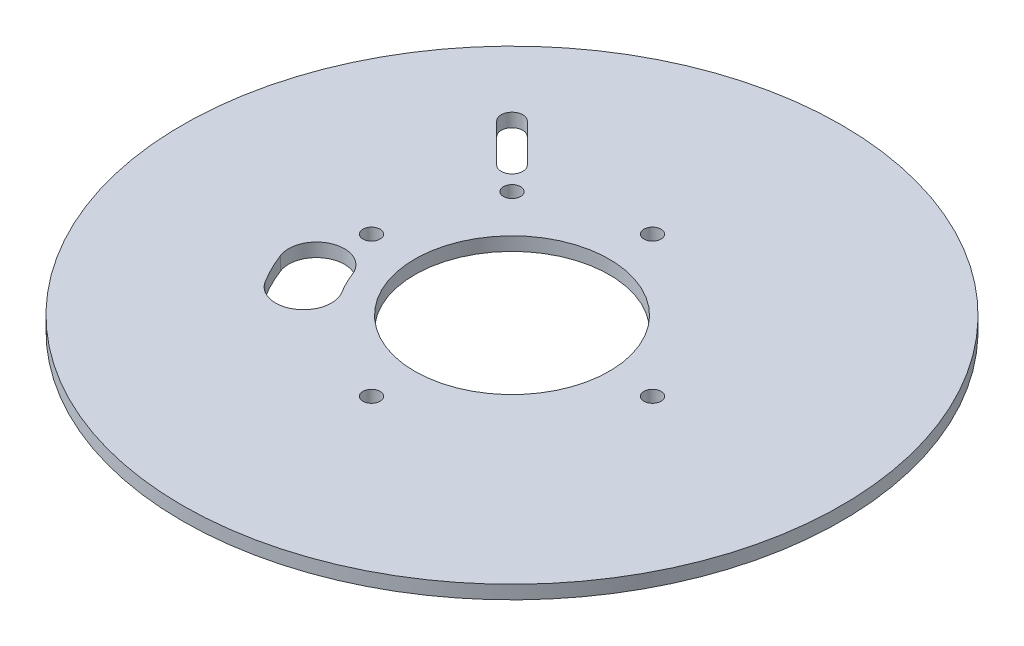
from build123d import *

# Parameters (mm, degrees)
SKETCH1_R           = 77.4600051
BOSS_EXTRUDE1_DEPTH = 3.175
SKETCH20_R          = 22.86
SKETCH20_R_2        = 2.0193
CUT_EXTRUDE10_DEPTH = 250.596695835
CUT_EXTRUDE11_DEPTH = 3.175
SKETCH22_R          = 2.0193
CUT_EXTRUDE12_DEPTH = 250.596695835
CUT_EXTRUDE13_DEPTH = 250.596695835


with BuildPart() as part:
    # Sketch1 → Boss-Extrude1 (new body)
    with BuildSketch(Plane(origin=(0, 0, 0), x_dir=(1, 0, 0), z_dir=(0, 1, 0))):
        with Locations(Location((0, 0, 0), (0, 0, 270))):
            Circle(SKETCH1_R)
    extrude(amount=BOSS_EXTRUDE1_DEPTH)

    # Sketch20 → Cut-Extrude10 (cut, through all)
    with BuildSketch(Plane(origin=(-73.768816189, 3.175, -121.080352405), x_dir=(1, 0, 0), z_dir=(0, 1, 0))):
        with Locations(Location((73.768816189, -121.080352405, 0), (0, 0, 270))):
            Circle(SKETCH20_R)
        with Locations(Location((73.768816189, -88.060352405, 0), (0, 0, 270))):
            Circle(SKETCH20_R_2)
        with Locations(Location((106.788816189, -121.080352405, 0), (0, 0, 270))):
            Circle(SKETCH20_R_2)
        with Locations(Location((73.768816189, -154.100352405, 0), (0, 0, 270))):
            Circle(SKETCH20_R_2)
        with Locations(Location((40.748816189, -121.080352405, 0), (0, 0, 270))):
            Circle(SKETCH20_R_2)
    extrude(amount=-CUT_EXTRUDE10_DEPTH, mode=Mode.SUBTRACT)

    # Sketch21 → Cut-Extrude11 (cut)
    with BuildSketch(Plane(origin=(-73.768816189, 3.175, -121.080352405), x_dir=(1, 0, 0), z_dir=(0, 1, 0))):
        with BuildLine():
            Line((41.420818538, -92.324457203), (32.440562417, -83.344201082))
            ThreePointArc((32.440562417, -83.344201082), (32.440562417, -79.752098633), (36.032664865, -79.752098633))
            Line((36.032664865, -79.752098633), (45.012920986, -88.732354754))
            ThreePointArc((45.012920986, -88.732354754), (45.012920986, -92.324457203), (41.420818538, -92.324457203))
        make_face()
    extrude(amount=-CUT_EXTRUDE11_DEPTH, mode=Mode.SUBTRACT)

    # Sketch22 → Cut-Extrude12 (cut, through all)
    with BuildSketch(Plane(origin=(-73.768816189, 3.175, -121.080352405), x_dir=(1, 0, 0), z_dir=(0, 1, 0))):
        with Locations(Location((48.605023435, -95.916559651, 0), (0, 0, 270))):
            Circle(SKETCH22_R)
    extrude(amount=-CUT_EXTRUDE12_DEPTH, mode=Mode.SUBTRACT)

    # Sketch23 → Cut-Extrude13 (cut, through all)
    with BuildSketch(Plane(origin=(-73.768816189, 3.175, -121.080352405), x_dir=(1, 0, 0), z_dir=(0, 1, 0))):
        with BuildLine():
            ThreePointArc((34.405967979, -136.122213123), (36.00963526, -139.786919397), (37.953573181, -143.283049568))
            ThreePointArc((37.953573181, -143.283049568), (46.974494303, -145.399596657), (49.091041391, -136.378675534))
            ThreePointArc((49.091041391, -136.378675534), (47.751609959, -133.969737166), (46.646635186, -131.444644817))
            ThreePointArc((46.646635186, -131.444644817), (38.18751743, -127.663095366), (34.405967979, -136.122213123))
        make_face()
    extrude(amount=-CUT_EXTRUDE13_DEPTH, mode=Mode.SUBTRACT)


solid = part.part
